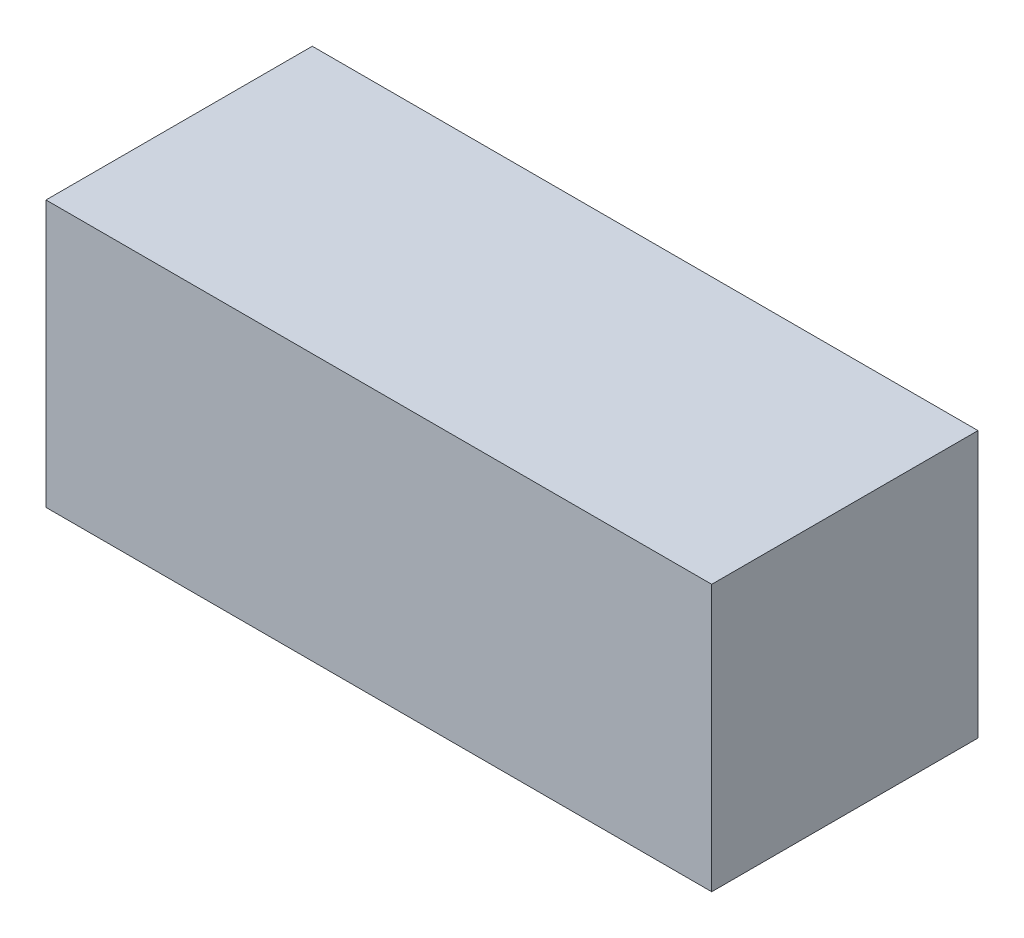
from build123d import *

# Parameters (mm, degrees)
SKETCH_1_W      = 100
SKETCH_1_H      = 100
EXTRUDE_1_DEPTH = 250


with BuildPart() as part:
    # 草图1 → 凸台-拉伸1 (new body)
    with BuildSketch(Plane(origin=(0, 0, 0), x_dir=(0, 0, -1), z_dir=(1, 0, 0))):
        with Locations((10.704960836, 5.035758607)):
            Rectangle(SKETCH_1_W, SKETCH_1_H)
    extrude(amount=EXTRUDE_1_DEPTH)


solid = part.part
